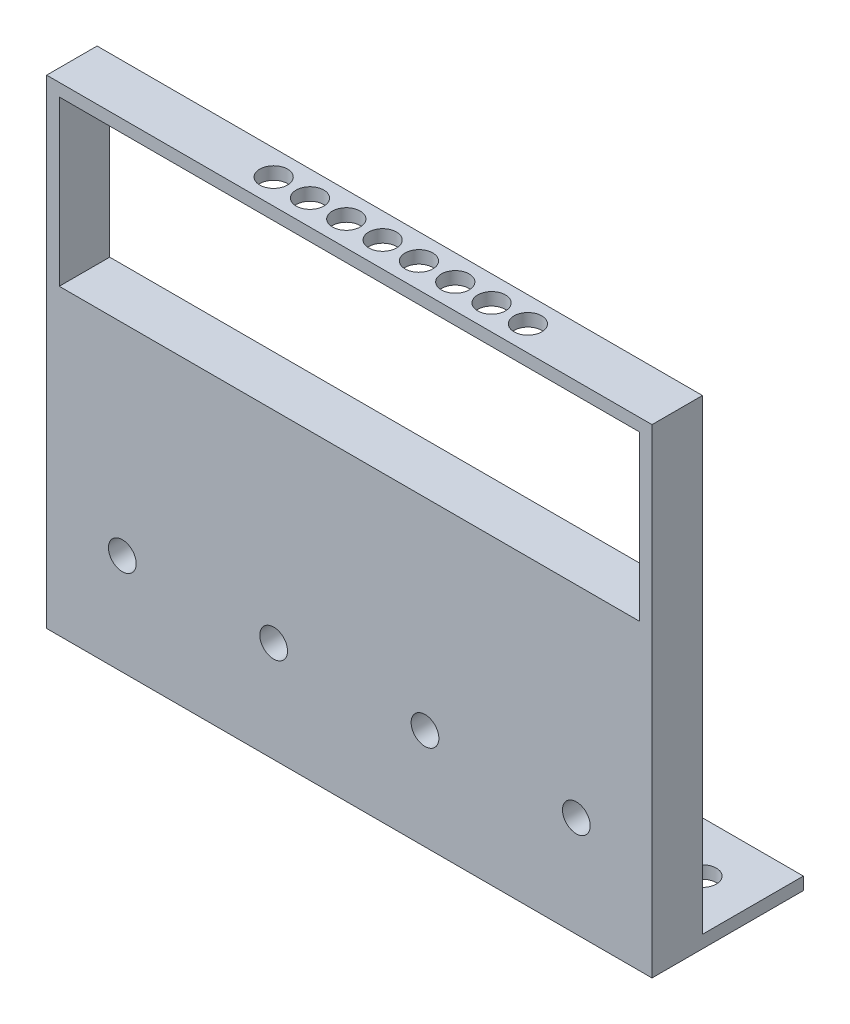
from build123d import *

# Parameters (mm, degrees)
SKETCH1_W               = 152.4
SKETCH1_H               = 12.7
BOSS_EXTRUDE1_DEPTH     = 76.2
SKETCH2_R               = 3.4925
BOSS_EXTRUDE4_DEPTH     = 3.175
BOSS_EXTRUDE5_DEPTH     = 12.7
CUT_EXTRUDE1_REACH      = 148.188
SKETCH4_R               = 3.4925
CUT_EXTRUDE2_DEPTH      = 147.187978302
CUT_EXTRUDE2_DEPTH_BACK = 147.187978302
SKETCH5_R               = 3.4925


with BuildPart() as part:
    # Sketch1 → Boss-Extrude1 (new body)
    with BuildSketch(Plane(origin=(0, 0, 0), x_dir=(1, 0, 0), z_dir=(0, 1, 0))):
        Rectangle(SKETCH1_W, SKETCH1_H)
    extrude(amount=BOSS_EXTRUDE1_DEPTH)

    # Sketch2 → Boss-Extrude4 (add)
    with BuildSketch(Plane(origin=(0, 0, 0), x_dir=(1, 0, 0), z_dir=(0, 1, 0))):
        Polygon((-76.2, 19.05), (-76.2, 6.35), (76.2, 6.35), (76.2, 31.75), (-76.2, 31.75), align=None)
        with Locations(Location((-63.5, 19.05, 0), (0, 0, 270))):
            Circle(SKETCH2_R, mode=Mode.SUBTRACT)
        with Locations(Location((-38.1, 19.05, 0), (0, 0, 270))):
            Circle(SKETCH2_R, mode=Mode.SUBTRACT)
        with Locations(Location((-12.7, 19.05, 0), (0, 0, 270))):
            Circle(SKETCH2_R, mode=Mode.SUBTRACT)
        with Locations(Location((12.7, 19.05, 0), (0, 0, 270))):
            Circle(SKETCH2_R, mode=Mode.SUBTRACT)
        with Locations(Location((38.1, 19.05, 0), (0, 0, 270))):
            Circle(SKETCH2_R, mode=Mode.SUBTRACT)
        with Locations(Location((63.5, 19.05, 0), (0, 0, 270))):
            Circle(SKETCH2_R, mode=Mode.SUBTRACT)
    extrude(amount=BOSS_EXTRUDE4_DEPTH)

    # Sketch3 → Boss-Extrude5 (add)
    with BuildSketch(Plane.XY.offset(6.35)):
        Polygon((-76.2, 76.2), (-76.2, 120.65), (76.2, 120.65), (76.2, 76.2), (73.025, 76.2), (73.025, 117.475), (-73.025, 117.475), (-73.025, 76.2), align=None)
    extrude(amount=-BOSS_EXTRUDE5_DEPTH)

    # Sketch4 → Cut-Extrude1 (cut, up to next)
    with BuildSketch(Plane(origin=(0, 120.65, 0), x_dir=(1, 0, 0), z_dir=(0, 1, 0)), mode=Mode.PRIVATE) as cut_extrude1_sk1:
        with Locations(Location((-25.4, 0, 0), (0, 0, 270))):
            Circle(SKETCH4_R)
    cut_extrude1_tool1 = extrude(cut_extrude1_sk1.sketch, amount=-CUT_EXTRUDE1_REACH, mode=Mode.PRIVATE) & part.part
    # Sketch4 → Cut-Extrude1 (cut, up to next)
    with BuildSketch(Plane(origin=(0, 120.65, 0), x_dir=(1, 0, 0), z_dir=(0, 1, 0)), mode=Mode.PRIVATE) as cut_extrude1_sk2:
        with Locations(Location((-16.256, 0, 0), (0, 0, 270))):
            Circle(SKETCH4_R)
    cut_extrude1_tool2 = extrude(cut_extrude1_sk2.sketch, amount=-CUT_EXTRUDE1_REACH, mode=Mode.PRIVATE) & part.part
    # Sketch4 → Cut-Extrude1 (cut, up to next)
    with BuildSketch(Plane(origin=(0, 120.65, 0), x_dir=(1, 0, 0), z_dir=(0, 1, 0)), mode=Mode.PRIVATE) as cut_extrude1_sk3:
        with Locations(Location((-7.112, 0, 0), (0, 0, 270))):
            Circle(SKETCH4_R)
    cut_extrude1_tool3 = extrude(cut_extrude1_sk3.sketch, amount=-CUT_EXTRUDE1_REACH, mode=Mode.PRIVATE) & part.part
    # Sketch4 → Cut-Extrude1 (cut, up to next)
    with BuildSketch(Plane(origin=(0, 120.65, 0), x_dir=(1, 0, 0), z_dir=(0, 1, 0)), mode=Mode.PRIVATE) as cut_extrude1_sk4:
        with Locations(Location((2.032, 0, 0), (0, 0, 270))):
            Circle(SKETCH4_R)
    cut_extrude1_tool4 = extrude(cut_extrude1_sk4.sketch, amount=-CUT_EXTRUDE1_REACH, mode=Mode.PRIVATE) & part.part
    # Sketch4 → Cut-Extrude1 (cut, up to next)
    with BuildSketch(Plane(origin=(0, 120.65, 0), x_dir=(1, 0, 0), z_dir=(0, 1, 0)), mode=Mode.PRIVATE) as cut_extrude1_sk5:
        with Locations(Location((11.176, 0, 0), (0, 0, 270))):
            Circle(SKETCH4_R)
    cut_extrude1_tool5 = extrude(cut_extrude1_sk5.sketch, amount=-CUT_EXTRUDE1_REACH, mode=Mode.PRIVATE) & part.part
    # Sketch4 → Cut-Extrude1 (cut, up to next)
    with BuildSketch(Plane(origin=(0, 120.65, 0), x_dir=(1, 0, 0), z_dir=(0, 1, 0)), mode=Mode.PRIVATE) as cut_extrude1_sk6:
        with Locations(Location((20.32, 0, 0), (0, 0, 270))):
            Circle(SKETCH4_R)
    cut_extrude1_tool6 = extrude(cut_extrude1_sk6.sketch, amount=-CUT_EXTRUDE1_REACH, mode=Mode.PRIVATE) & part.part
    # Sketch4 → Cut-Extrude1 (cut, up to next)
    with BuildSketch(Plane(origin=(0, 120.65, 0), x_dir=(1, 0, 0), z_dir=(0, 1, 0)), mode=Mode.PRIVATE) as cut_extrude1_sk7:
        with Locations(Location((29.464, 0, 0), (0, 0, 270))):
            Circle(SKETCH4_R)
    cut_extrude1_tool7 = extrude(cut_extrude1_sk7.sketch, amount=-CUT_EXTRUDE1_REACH, mode=Mode.PRIVATE) & part.part
    # Sketch4 → Cut-Extrude1 (cut, up to next)
    with BuildSketch(Plane(origin=(0, 120.65, 0), x_dir=(1, 0, 0), z_dir=(0, 1, 0)), mode=Mode.PRIVATE) as cut_extrude1_sk8:
        with Locations(Location((38.608, 0, 0), (0, 0, 270))):
            Circle(SKETCH4_R)
    cut_extrude1_tool8 = extrude(cut_extrude1_sk8.sketch, amount=-CUT_EXTRUDE1_REACH, mode=Mode.PRIVATE) & part.part
    add(cut_extrude1_tool1.solids().sort_by_distance((-25.4, 120.65, 0))[0], mode=Mode.SUBTRACT)
    add(cut_extrude1_tool2.solids().sort_by_distance((-16.256, 120.65, 0))[0], mode=Mode.SUBTRACT)
    add(cut_extrude1_tool3.solids().sort_by_distance((-7.112, 120.65, 0))[0], mode=Mode.SUBTRACT)
    add(cut_extrude1_tool4.solids().sort_by_distance((2.032, 120.65, 0))[0], mode=Mode.SUBTRACT)
    add(cut_extrude1_tool5.solids().sort_by_distance((11.176, 120.65, 0))[0], mode=Mode.SUBTRACT)
    add(cut_extrude1_tool6.solids().sort_by_distance((20.32, 120.65, 0))[0], mode=Mode.SUBTRACT)
    add(cut_extrude1_tool7.solids().sort_by_distance((29.464, 120.65, 0))[0], mode=Mode.SUBTRACT)
    add(cut_extrude1_tool8.solids().sort_by_distance((38.608, 120.65, 0))[0], mode=Mode.SUBTRACT)

    # Sketch5 → Cut-Extrude2 (cut, two sides: drawn at the far end of the back side and taken through both)
    with BuildSketch(Plane.XY.offset(-CUT_EXTRUDE2_DEPTH_BACK)):
        with Locations((-57.15, 25.4)):
            Circle(SKETCH5_R)
        with Locations((-19.05, 25.4)):
            Circle(SKETCH5_R)
        with Locations((19.05, 25.4)):
            Circle(SKETCH5_R)
        with Locations((57.15, 25.4)):
            Circle(SKETCH5_R)
    extrude(amount=CUT_EXTRUDE2_DEPTH + CUT_EXTRUDE2_DEPTH_BACK, mode=Mode.SUBTRACT)


solid = part.part
